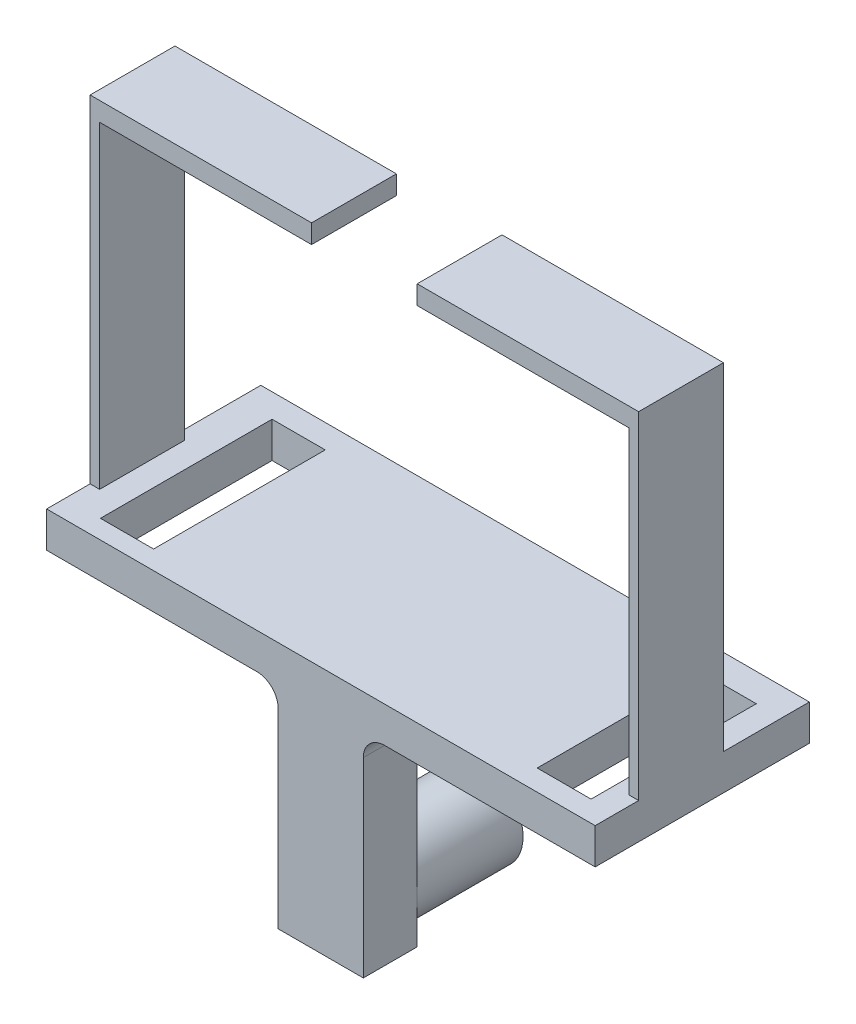
from build123d import *

# Parameters (mm, degrees)
SKETCH6_W            = 10.1981
SKETCH6_H            = 6.43128
BOSS_EXTRUDE3_DEPTH  = 25.4
SKETCH8_R            = 5.09905
BOSS_EXTRUDE5_DEPTH  = 12.7
SKETCH11_W           = 65.69456
SKETCH11_H           = 25.654
SKETCH11_W_2         = 6.368021248
SKETCH11_H_2         = 20.557169264
SKETCH11_W_3         = 6.453498043
SKETCH11_H_3         = 19.787878106
BOSS_EXTRUDE10_DEPTH = 4.28752
SKETCH16_W           = 1.143
SKETCH16_H           = 10.16
BOSS_EXTRUDE11_DEPTH = 38.0746
SKETCH17_W           = 26.52268
SKETCH17_H           = 10.16
BOSS_EXTRUDE12_DEPTH = 2.2606
FILLET2_R            = 2.54
FILLET3_R            = 2.54
FILLET4_R            = 2.54
SKETCH19_R           = 4.064
CUT_EXTRUDE1_DEPTH   = 12.7


with BuildPart() as part:
    # Sketch6 → Boss-Extrude3 (new body)
    with BuildSketch(Plane(origin=(0, 0, 0), x_dir=(1, 0, 0), z_dir=(0, 1, 0))):
        with Locations((-12.169797761, 10.84768804)):
            Rectangle(SKETCH6_W, SKETCH6_H)
    extrude(amount=BOSS_EXTRUDE3_DEPTH)

    # Sketch8 → Boss-Extrude5 (add)
    with BuildSketch(Plane.XY.offset(-14.06332804)):
        with Locations((-12.169797761, 5.098542)):
            Circle(SKETCH8_R)
    extrude(amount=-BOSS_EXTRUDE5_DEPTH)

    # Sketch11 → Boss-Extrude10 (add)
    with BuildSketch(Plane(origin=(0, 25.4, 0), x_dir=(1, 0, 0), z_dir=(0, 1, 0))):
        with Locations((-12.150747761, 20.45904804)):
            Rectangle(SKETCH11_W, SKETCH11_H)
        with Locations((-37.622832753, 20.159879257)):
            Rectangle(SKETCH11_W_2, SKETCH11_H_2, mode=Mode.SUBTRACT)
        with Locations((14.475273968, 20.031664064)):
            Rectangle(SKETCH11_W_3, SKETCH11_H_3, mode=Mode.SUBTRACT)
    extrude(amount=BOSS_EXTRUDE10_DEPTH)

    # Sketch16 → Boss-Extrude11 (add)
    with BuildSketch(Plane(origin=(0, 29.68752, 0), x_dir=(1, 0, 0), z_dir=(0, 1, 0))):
        with Locations((-44.426527761, 17.91904804)):
            Rectangle(SKETCH16_W, SKETCH16_H)
        with Locations((20.125032239, 17.91904804)):
            Rectangle(SKETCH16_W, SKETCH16_H)
    extrude(amount=BOSS_EXTRUDE11_DEPTH)

    # Sketch17 → Boss-Extrude12 (add)
    with BuildSketch(Plane(origin=(0, 67.76212, 0), x_dir=(1, 0, 0), z_dir=(0, 1, 0))):
        with Locations((-31.736687761, 17.91904804)):
            Rectangle(SKETCH17_W, SKETCH17_H)
        with Locations((7.435192239, 17.91904804)):
            Rectangle(SKETCH17_W, SKETCH17_H)
    extrude(amount=BOSS_EXTRUDE12_DEPTH)

    # Fillet2
    fillet2_edges = [part.edges().sort_by_distance(p)[0] for p in [
        (-12.169797761, 25.4, -14.06332804),
    ]]
    fillet(fillet2_edges, radius=FILLET2_R)

    # Fillet3
    fillet3_edges = [part.edges().sort_by_distance(p)[0] for p in [
        (-17.268847761, 25.4, -12.11768804),
    ]]
    fillet(fillet3_edges, radius=FILLET3_R)

    # Fillet4
    fillet4_edges = [part.edges().sort_by_distance(p)[0] for p in [
        (-7.070747761, 25.4, -12.11768804),
    ]]
    fillet(fillet4_edges, radius=FILLET4_R)

    # Sketch19 → Cut-Extrude1 (cut)
    with BuildSketch(Plane(origin=(0, 0, -26.76332804), x_dir=(-1, 0, 0), z_dir=(0, 0, -1))):
        with Locations((12.169797761, 5.098542)):
            Circle(SKETCH19_R)
    extrude(amount=-CUT_EXTRUDE1_DEPTH, mode=Mode.SUBTRACT)


solid = part.part
